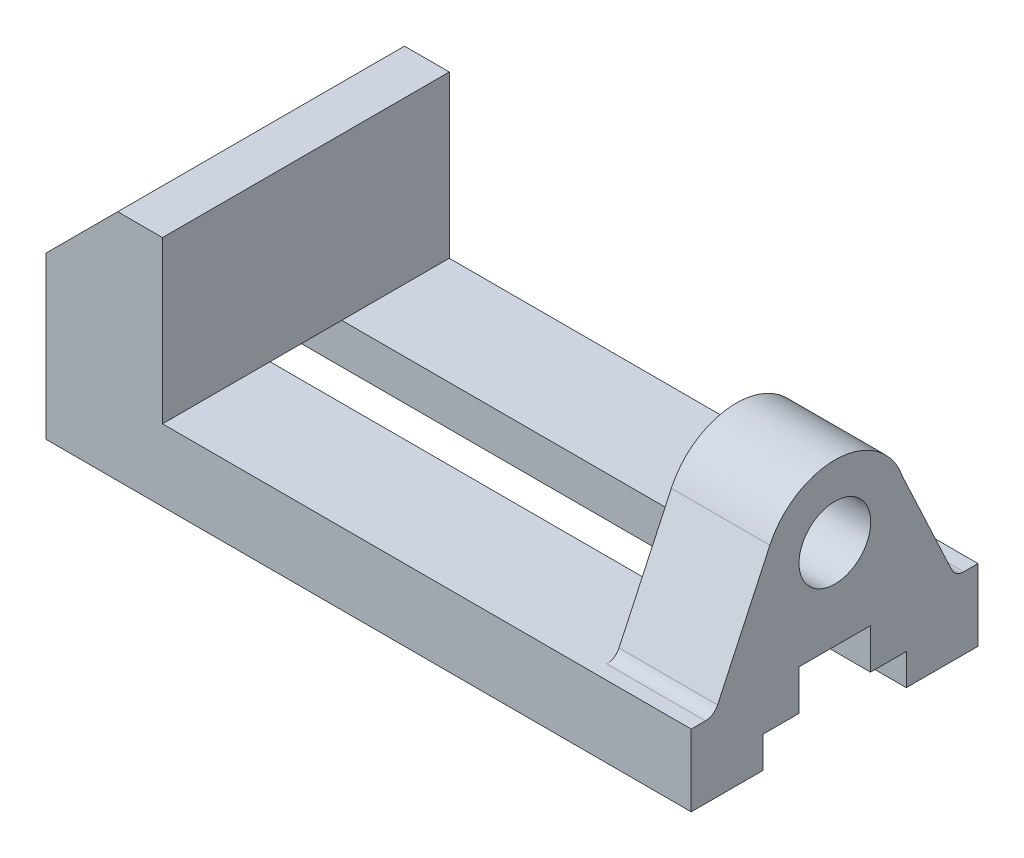
from build123d import *

# Parameters (mm, degrees)
BOSS_EXTRUDE1_DEPTH  = 32
BOSS_EXTRUDE7_DEPTH  = 22
SKETCH10_R           = 8
CUT_EXTRUDE1_DEPTH   = 22
FILLET1_R            = 3
FILLET2_R            = 3
CUT_EXTRUDE2_DEPTH   = 157.409718368
LPATTERN1_COUNT      = 2
LPATTERN1_PITCH      = 70
LPATTERN1_COUNT_DIR2 = 2
LPATTERN1_PITCH_DIR2 = 44


with BuildPart() as part:
    # Sketch3 → Boss-Extrude1 (new, symmetric)
    with BuildSketch(Plane.XY):
        Polygon((0, 0), (0, 36), (16, 52), (26, 52), (26, 16), (144, 16), (144, 0), align=None)
    extrude(amount=BOSS_EXTRUDE1_DEPTH, both=True)

    # Sketch4 → Boss-Extrude7 (add)
    with BuildSketch(Plane(origin=(144, 0, 0), x_dir=(0, 0, -1), z_dir=(1, 0, 0))):
        with BuildLine():
            Line((-26.927127132, 16), (-14.447851858, 42.761892188))
            ThreePointArc((-14.447851858, 42.761892188), (0.930343347, 51.975931781), (15.207195845, 41.133473752))
            Line((15.207195845, 41.133473752), (26.927127132, 16))
            Line((26.927127132, 16), (-26.927127132, 16))
        make_face()
    extrude(amount=-BOSS_EXTRUDE7_DEPTH)

    # Sketch10 → Cut-Extrude1 (cut)
    with BuildSketch(Plane(origin=(144, 0, 0), x_dir=(0, 0, -1), z_dir=(1, 0, 0))):
        with Locations((0.053072735, 36)):
            Circle(SKETCH10_R)
    extrude(amount=-CUT_EXTRUDE1_DEPTH, mode=Mode.SUBTRACT)

    # Fillet1
    fillet1_edges = [part.edges().sort_by_distance(p)[0] for p in [
        (133, 16, 26.927127132),
    ]]
    fillet(fillet1_edges, radius=FILLET1_R)

    # Fillet2
    fillet2_edges = [part.edges().sort_by_distance(p)[0] for p in [
        (133, 16, -26.927127132),
    ]]
    fillet(fillet2_edges, radius=FILLET2_R)

    # Sketch11 → Cut-Extrude2 (cut, through all)
    with BuildSketch(Plane(origin=(144, 0, 0), x_dir=(0, 0, -1), z_dir=(1, 0, 0))):
        Polygon((-16, -7.593125262), (-16, 7), (-8, 7), (-8, 16), (8, 16), (8, 7), (16, 7), (16, -7.593125262), align=None)
    extrude(amount=-CUT_EXTRUDE2_DEPTH, mode=Mode.SUBTRACT)

    # Sketch13 → Ø1.0mm Dowel Hole1 (revolve, cut)
    with BuildSketch(Plane(origin=(106, 0, 22), x_dir=(0, 0, -1), z_dir=(1, 0, 0))):
        Polygon((0, 0), (0, 11.732050808), (3, 10), (3, 0), align=None)
    f_1_0mm_dowel_hole1 = revolve(axis=Axis((106, -6.35, 22), (0, 1, 0)), mode=Mode.SUBTRACT)

    # LPattern1: 1.0mm Dowel Hole1 2 × 2
    with Locations(*[(-i * LPATTERN1_PITCH, 0, -j * LPATTERN1_PITCH_DIR2) for i in range(LPATTERN1_COUNT) for j in range(LPATTERN1_COUNT_DIR2) if (i, j) != (0, 0)]):
        add(f_1_0mm_dowel_hole1, mode=Mode.SUBTRACT)


solid = part.part
